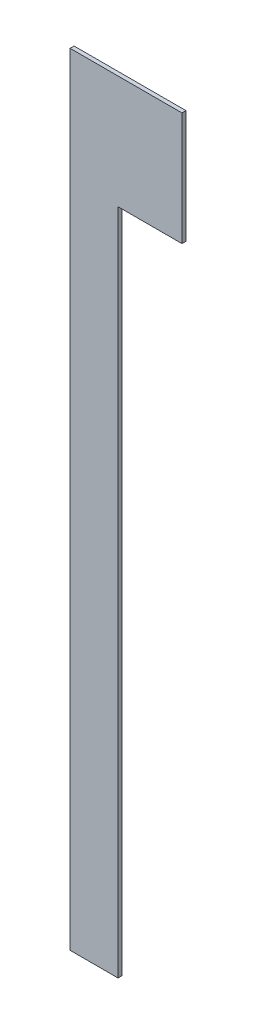
from build123d import *

# Parameters (mm, degrees)
EXTRUDE_1_DEPTH = 12.5


with BuildPart() as part:
    # Эскиз1 → Бобышка-Вытянуть1 (new body)
    with BuildSketch(Plane.XY):
        Polygon((350, -0.75), (0, -0.75), (0, -2445), (150, -2445), (150, -355), (350, -355), align=None)
    extrude(amount=-EXTRUDE_1_DEPTH)


solid = part.part
